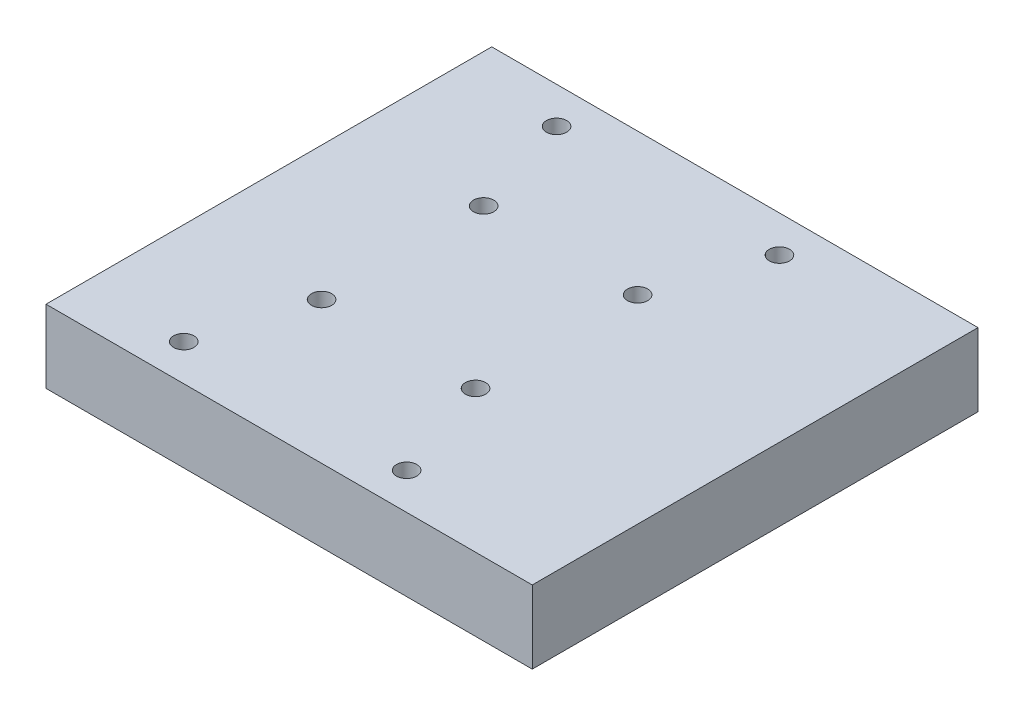
from build123d import *

# Parameters (mm, degrees)
SKETCH1_W                = 120
SKETCH1_H                = 110
BOSS_EXTRUDE1_DEPTH      = 18
F_5_0_5_DIAMETER_HOLE1_D = 5
F_5_0_5_DIAMETER_HOLE3_D = 5


with BuildPart() as part:
    # Sketch1 → Boss-Extrude1 (new body)
    with BuildSketch(Plane(origin=(0, 0, 0), x_dir=(1, 0, 0), z_dir=(0, 1, 0))):
        Rectangle(SKETCH1_W, SKETCH1_H)
    extrude(amount=BOSS_EXTRUDE1_DEPTH)

    # Ø5.0 (5) Diameter Hole1 (through all)
    with Locations(Plane(origin=(0, 0, 0), x_dir=(-1, 0, 0), z_dir=(0, -1, 0))):
        with Locations((-20, 46), (35, 46), (35, -46), (-20, -46)):
            Hole(F_5_0_5_DIAMETER_HOLE1_D / 2)

    # Ø5.0 (5) Diameter Hole3 (through all)
    with Locations(Plane(origin=(0, 0, 0), x_dir=(-1, 0, 0), z_dir=(0, -1, 0))):
        with Locations((27, 20), (-11, 20), (-11, -20), (27, -20)):
            Hole(F_5_0_5_DIAMETER_HOLE3_D / 2)


solid = part.part
